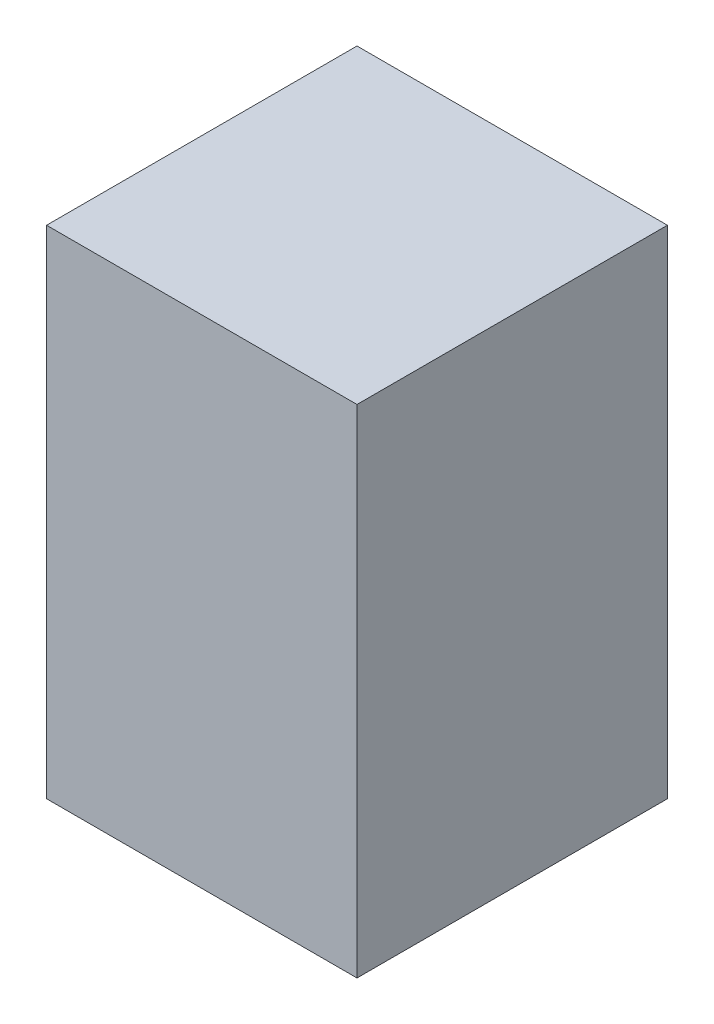
from build123d import *

# Parameters (mm, degrees)
SKETCH1_W           = 500
SKETCH1_H           = 800
BOSS_EXTRUDE1_DEPTH = 500


with BuildPart() as part:
    # Sketch1 → Boss-Extrude1 (new body)
    with BuildSketch(Plane.XY):
        with Locations((250, 400)):
            Rectangle(SKETCH1_W, SKETCH1_H)
    extrude(amount=BOSS_EXTRUDE1_DEPTH)


solid = part.part
